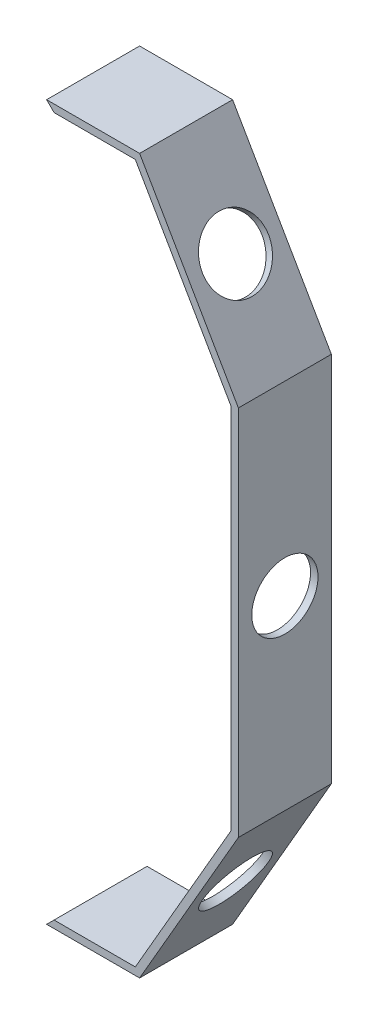
from build123d import *

# Parameters (mm, degrees)
SALIENTE_EXTRUIR2_DEPTH = 25
CROQUIS3_R              = 8.9
CORTAR_EXTRUIR1_DEPTH   = 25
CROQUIS4_R              = 8.9
CORTAR_EXTRUIR2_DEPTH   = 25
CROQUIS5_R              = 8.9
CORTAR_EXTRUIR3_DEPTH   = 25


with BuildPart() as part:
    # Croquis1 → Saliente-Extruir2 (new body)
    with BuildSketch(Plane.XY):
        Polygon((12.5, 96), (39.058112383, 50), (39.058112383, -50), (12.5, -96), (-12.5, -96), (-10.5, -94), (11.345299462, -94), (37.058112383, -49.464101615), (37.058112383, 49.464101615), (11.345299462, 94), (-10.5, 94), (-12.5, 96), align=None)
    extrude(amount=SALIENTE_EXTRUIR2_DEPTH)

    # Croquis3 → Cortar-Extruir1 (cut)
    with BuildSketch(Plane(origin=(39.058112383, 0, 0), x_dir=(0, 0, -1), z_dir=(1, 0, 0))):
        with Locations((-12.5, 0)):
            Circle(CROQUIS3_R)
    extrude(amount=-CORTAR_EXTRUIR1_DEPTH, mode=Mode.SUBTRACT)

    # Croquis4 → Cortar-Extruir2 (cut)
    with BuildSketch(Plane(origin=(50.944219382, 29.412658774, 0), x_dir=(0, 0, -1), z_dir=(0.8660254037844347, 0.500000000000007, 0))):
        with Locations(Location((-12.5, 50.330326381, 0), (0, 0, 90))):
            Circle(CROQUIS4_R)
    extrude(amount=-CORTAR_EXTRUIR2_DEPTH, mode=Mode.SUBTRACT)

    # Croquis5 → Cortar-Extruir3 (cut)
    with BuildSketch(Plane(origin=(50.944219382, -29.412658774, 0), x_dir=(0, 0, -1), z_dir=(0.8660254037844347, -0.500000000000007, 0))):
        with Locations(Location((-12.5, -50.330326381, 0), (0, 0, 90))):
            Circle(CROQUIS5_R)
    extrude(amount=-CORTAR_EXTRUIR3_DEPTH, mode=Mode.SUBTRACT)


solid = part.part
